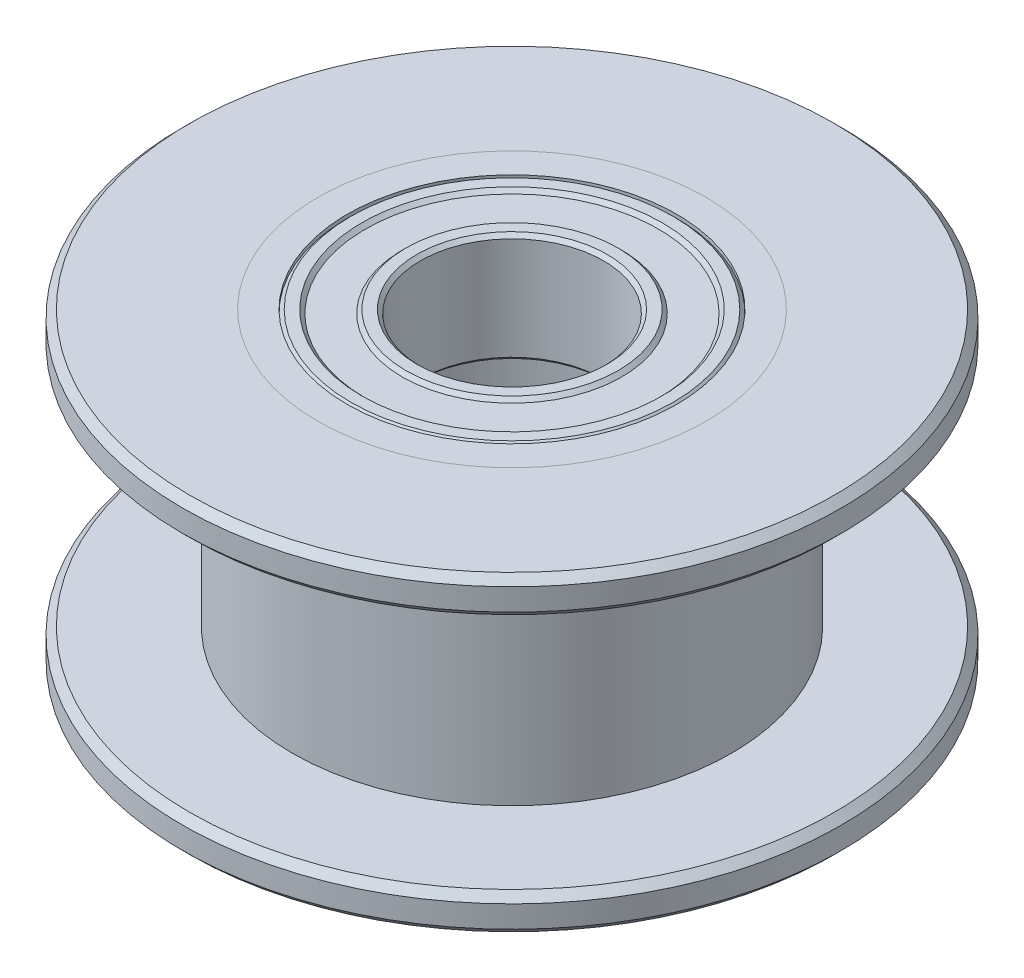
from build123d import *

# Parameters (mm, degrees)
SKICA2_R                  = 9
SKICA2_R_2                = 5.3
P_IDAT_VYSUNUT_M1_DEPTH   = 1
ZKOSEN_1_SIZE             = 0.2
SKICA3_R                  = 9
SKICA3_R_2                = 5.3
P_IDAT_VYSUNUT_M2_DEPTH   = 1
ZKOSEN_2_SIZE             = 0.2
SKICA4_R                  = 3
SKICA4_R_2                = 2.5
P_IDAT_VYSUNUT_M3_DEPTH   = 3
SKICA4_R_3                = 4.5
SKICA4_R_4                = 4
P_IDAT_VYSUNUT_M3_2_DEPTH = 3
P_IDAT_START              = 0.1
SKICA4_4_R                = 4
SKICA4_4_R_2              = 3
P_IDAT_VYSUNUT_M4_DEPTH   = 2.8
ZKOSEN_3_SIZE             = 0.1
ZKOSEN_4_SIZE             = 0.1
SKICA5_R                  = 3
SKICA5_R_2                = 2.5
P_IDAT_VYSUNUT_M6_DEPTH   = 3
SKICA5_R_3                = 4.5
SKICA5_R_4                = 4
P_IDAT_VYSUNUT_M6_2_DEPTH = 3
ZKOSEN_5_SIZE             = 0.1
ZKOSEN_6_SIZE             = 0.1
SKICA5_4_R                = 4
SKICA5_4_R_2              = 3
P_IDAT_VYSUNUT_M7_DEPTH   = 2.8


with BuildPart() as part:
    # Skica1 → Rotovat1 (revolve)
    with BuildSketch(Plane.XY, mode=Mode.PRIVATE) as rotovat1_sk:
        Polygon((-4.5, 8.5), (-5.3, 8.5), (-5.3, 7.5), (-6, 7.5), (-6, 1), (-5.3, 1), (-5.3, 0), (-4.5, 0), (-4.5, 3), (-4, 3), (-4, 5.5), (-4.5, 5.5), align=None)
    revolve(rotovat1_sk.sketch.rotate(Axis((0, 8.5, 0), (0, -1, 0)), 270), axis=Axis((0, 8.5, 0), (0, -1, 0)))


with BuildPart() as body_2:
    # Skica2 → Přidat vysunutím1 (new body)
    with BuildSketch(Plane(origin=(0, 7.5, 0), x_dir=(1, 0, 0), z_dir=(0, 1, 0))):
        with Locations(Location((0, 0, 0), (0, 0, 270))):
            Circle(SKICA2_R)
        with Locations(Location((0, 0, 0), (0, 0, 270))):
            Circle(SKICA2_R_2, mode=Mode.SUBTRACT)
    extrude(amount=P_IDAT_VYSUNUT_M1_DEPTH)

    # Zkosení1
    zkosen_1_edges = [body_2.edges().sort_by_distance(p)[0] for p in [
        (0, 7.5, -9),
        (0, 8.5, -9),
    ]]
    chamfer(zkosen_1_edges, length=ZKOSEN_1_SIZE)


with BuildPart() as body_3:
    # Skica3 → Přidat vysunutím2 (new body)
    with BuildSketch(Plane.XZ.offset(-1)):
        with Locations(Location((0, 0, 0), (0, 0, 270))):
            Circle(SKICA3_R)
        with Locations(Location((0, 0, 0), (0, 0, 270))):
            Circle(SKICA3_R_2, mode=Mode.SUBTRACT)
    extrude(amount=P_IDAT_VYSUNUT_M2_DEPTH)

    # Zkosení2
    zkosen_2_edges = [body_3.edges().sort_by_distance(p)[0] for p in [
        (0, 1, 9),
        (0, 0, 9),
    ]]
    chamfer(zkosen_2_edges, length=ZKOSEN_2_SIZE)


with BuildPart() as body_4:
    # Skica4 → Přidat vysunutím3 (new body)
    with BuildSketch(Plane(origin=(0, 5.5, 0), x_dir=(1, 0, 0), z_dir=(0, 1, 0))):
        with Locations(Location((0, 0, 0), (0, 0, 270))):
            Circle(SKICA4_R)
        with Locations(Location((0, 0, 0), (0, 0, 270))):
            Circle(SKICA4_R_2, mode=Mode.SUBTRACT)
    extrude(amount=P_IDAT_VYSUNUT_M3_DEPTH)

    # Zkosení3
    zkosen_3_edges = [body_4.edges().sort_by_distance(p)[0] for p in [
        (0, 5.5, -3),
        (0, 5.5, -2.5),
        (0, 8.5, -2.5),
        (0, 8.5, -3),
    ]]
    chamfer(zkosen_3_edges, length=ZKOSEN_3_SIZE)


with BuildPart() as body_5:
    # Skica4 → P_idat vysunut_m3 2 (new body)
    with BuildSketch(Plane(origin=(0, 5.5, 0), x_dir=(1, 0, 0), z_dir=(0, 1, 0))):
        with Locations(Location((0, 0, 0), (0, 0, 270))):
            Circle(SKICA4_R_3)
        with Locations(Location((0, 0, 0), (0, 0, 270))):
            Circle(SKICA4_R_4, mode=Mode.SUBTRACT)
    extrude(amount=P_IDAT_VYSUNUT_M3_2_DEPTH)

    # Zkosení4
    zkosen_4_edges = [body_5.edges().sort_by_distance(p)[0] for p in [
        (0, 8.5, -4.5),
        (0, 5.5, -4.5),
        (0, 5.5, -4),
        (0, 8.5, -4),
    ]]
    chamfer(zkosen_4_edges, length=ZKOSEN_4_SIZE)


with BuildPart() as body_6:
    # Skica4<4> → Přidat vysunutím4 (new body)
    with BuildSketch(Plane(origin=(0, 5.5, 0), x_dir=(1, 0, 0), z_dir=(0, 1, 0)).offset(P_IDAT_START)):
        with Locations(Location((0, 0, 0), (0, 0, 270))):
            Circle(SKICA4_4_R)
        with Locations(Location((0, 0, 0), (0, 0, 270))):
            Circle(SKICA4_4_R_2, mode=Mode.SUBTRACT)
    extrude(amount=P_IDAT_VYSUNUT_M4_DEPTH)


with BuildPart() as body_7:
    # Skica5 → Přidat vysunutím6 (new body)
    with BuildSketch(Plane.XZ.offset(-3)):
        with Locations(Location((0, 0, 0), (0, 0, 270))):
            Circle(SKICA5_R)
        with Locations(Location((0, 0, 0), (0, 0, 270))):
            Circle(SKICA5_R_2, mode=Mode.SUBTRACT)
    extrude(amount=P_IDAT_VYSUNUT_M6_DEPTH)

    # Zkosení5
    zkosen_5_edges = [body_7.edges().sort_by_distance(p)[0] for p in [
        (0, 3, 3),
        (0, 3, 2.5),
        (0, 0, 2.5),
        (0, 0, 3),
    ]]
    chamfer(zkosen_5_edges, length=ZKOSEN_5_SIZE)


with BuildPart() as body_8:
    # Skica5 → P_idat vysunut_m6 2 (new body)
    with BuildSketch(Plane.XZ.offset(-3)):
        with Locations(Location((0, 0, 0), (0, 0, 270))):
            Circle(SKICA5_R_3)
        with Locations(Location((0, 0, 0), (0, 0, 270))):
            Circle(SKICA5_R_4, mode=Mode.SUBTRACT)
    extrude(amount=P_IDAT_VYSUNUT_M6_2_DEPTH)

    # Zkosení6
    zkosen_6_edges = [body_8.edges().sort_by_distance(p)[0] for p in [
        (0, 0, 4),
        (0, 3, 4),
        (0, 3, 4.5),
        (0, 0, 4.5),
    ]]
    chamfer(zkosen_6_edges, length=ZKOSEN_6_SIZE)


with BuildPart() as body_9:
    # Skica5<4> → Přidat vysunutím7 (new body)
    with BuildSketch(Plane.XZ.offset(-3).offset(P_IDAT_START)):
        with Locations(Location((0, 0, 0), (0, 0, 270))):
            Circle(SKICA5_4_R)
        with Locations(Location((0, 0, 0), (0, 0, 270))):
            Circle(SKICA5_4_R_2, mode=Mode.SUBTRACT)
    extrude(amount=P_IDAT_VYSUNUT_M7_DEPTH)


solid = Compound([part.part, body_2.part, body_3.part, body_4.part, body_5.part, body_6.part, body_7.part, body_8.part, body_9.part])
